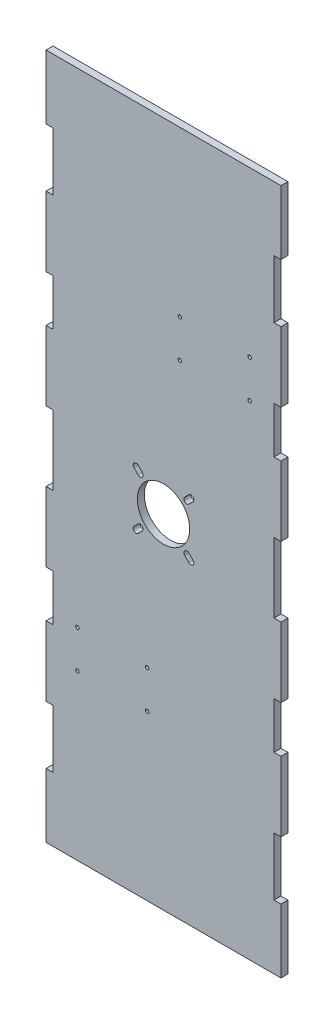
from build123d import *

# Parameters (mm, degrees)
SKETCH1_R           = 1.5
SKETCH1_R_2         = 22.511799613
BOSS_EXTRUDE1_DEPTH = 6


with BuildPart() as part:
    # Sketch1 → Boss-Extrude1 (new body)
    with BuildSketch(Plane.XY):
        Polygon((114.346400169, -107.26425955), (114.346400169, -67.26425955), (120.346400169, -67.26425955), (120.346400169, -7.26425955), (114.346400169, -7.26425955), (114.346400169, 52.73574045), (120.346400169, 52.73574045), (120.346400169, 112.73574045), (114.346400169, 112.73574045), (114.346400169, 152.73574045), (120.346400169, 152.73574045), (120.346400169, 212.73574045), (114.346400169, 212.73574045), (114.346400169, 262.73574045), (120.346400169, 262.73574045), (120.346400169, 317.807433635), (-81.653599831, 317.807433635), (-81.653599831, 262.73574045), (-75.653599831, 262.73574045), (-75.653599831, 212.73574045), (-81.653599831, 212.73574045), (-81.653599831, 152.73574045), (-75.653599831, 152.73574045), (-75.653599831, 112.73574045), (-81.653599831, 112.73574045), (-81.653599831, 52.73574045), (-75.653599831, 52.73574045), (-75.653599831, -7.26425955), (-81.653599831, -7.26425955), (-81.653599831, -67.26425955), (-75.653599831, -67.26425955), (-75.653599831, -107.26425955), (-81.653599831, -107.26425955), (-81.653599831, -167.26425955), (-75.653599831, -167.26425955), (-75.653599831, -217.26425955), (-81.653599831, -217.26425955), (-81.653599831, -272.335952735), (120.346400169, -272.335952735), (120.346400169, -217.26425955), (114.346400169, -217.26425955), (114.346400169, -167.26425955), (120.346400169, -167.26425955), (120.346400169, -107.26425955), align=None)
        with Locations((93.421400169, 144.187215683)):
            Circle(SKETCH1_R, mode=Mode.SUBTRACT)
        with Locations((93.421400169, 176.66641252)):
            Circle(SKETCH1_R, mode=Mode.SUBTRACT)
        with Locations((33.421400169, 144.187215683)):
            Circle(SKETCH1_R, mode=Mode.SUBTRACT)
        with Locations((-54.728599831, -131.19493162)):
            Circle(SKETCH1_R, mode=Mode.SUBTRACT)
        with Locations((33.421400169, 176.66641252)):
            Circle(SKETCH1_R, mode=Mode.SUBTRACT)
        with Locations((-54.728599831, -98.715734783)):
            Circle(SKETCH1_R, mode=Mode.SUBTRACT)
        with Locations((5.271400169, -98.715734783)):
            Circle(SKETCH1_R, mode=Mode.SUBTRACT)
        with Locations((19.346400169, 22.73574045)):
            Circle(SKETCH1_R_2, mode=Mode.SUBTRACT)
        with Locations((5.271400169, -131.19493162)):
            Circle(SKETCH1_R, mode=Mode.SUBTRACT)
        with BuildLine():
            Line((41.149833216, -2.603226503), (37.611612305, 0.934994409))
            ThreePointArc((37.611612305, 0.934994409), (37.611612305, 4.470528314), (41.147146211, 4.470528314))
            Line((41.147146211, 4.470528314), (44.685367122, 0.932307403))
            ThreePointArc((44.685367122, 0.932307403), (44.685367122, -2.603226503), (41.149833216, -2.603226503))
        make_face(mode=Mode.SUBTRACT)
        with BuildLine():
            Line((-5.992566784, 0.932307403), (-2.454345872, 4.470528314))
            ThreePointArc((-2.454345872, 4.470528314), (1.081188034, 4.470528314), (1.081188034, 0.934994409))
            Line((1.081188034, 0.934994409), (-2.457032878, -2.603226503))
            ThreePointArc((-2.457032878, -2.603226503), (-5.992566784, -2.603226503), (-5.992566784, 0.932307403))
        make_face(mode=Mode.SUBTRACT)
        with BuildLine():
            Line((-2.457032878, 48.074707403), (1.081188034, 44.536486491))
            ThreePointArc((1.081188034, 44.536486491), (1.081188034, 41.000952585), (-2.454345872, 41.000952585))
            Line((-2.454345872, 41.000952585), (-5.992566784, 44.539173497))
            ThreePointArc((-5.992566784, 44.539173497), (-5.992566784, 48.074707403), (-2.457032878, 48.074707403))
        make_face(mode=Mode.SUBTRACT)
        with BuildLine():
            Line((44.685367122, 44.539173497), (41.147146211, 41.000952585))
            ThreePointArc((41.147146211, 41.000952585), (37.611612305, 41.000952585), (37.611612305, 44.536486491))
            Line((37.611612305, 44.536486491), (41.149833216, 48.074707403))
            ThreePointArc((41.149833216, 48.074707403), (44.685367122, 48.074707403), (44.685367122, 44.539173497))
        make_face(mode=Mode.SUBTRACT)
    extrude(amount=BOSS_EXTRUDE1_DEPTH)


solid = part.part
